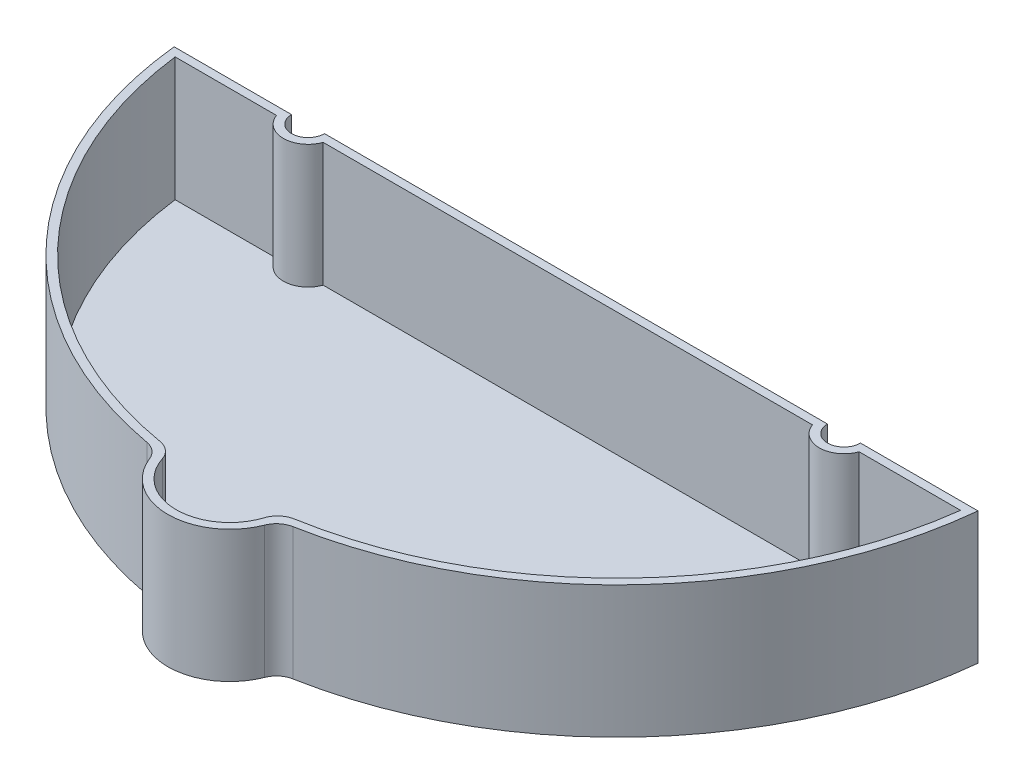
from build123d import *

# Parameters (mm, degrees)
EXTRUDE_START   = -2
EXTRUDE_1_DEPTH = 32
SHELL_1_T       = -2
FILLET_1_R      = 5


with BuildPart() as part:
    # 草图1 → 凸台-拉伸1 (new body)
    with BuildSketch(Plane(origin=(0, 0, 0), x_dir=(1, 0, 0), z_dir=(0, 1, 0)).offset(EXTRUDE_START)):
        with BuildLine():
            Line((-97.488460856, 50), (-69, 50))
            ThreePointArc((-69, 50), (-65, 46), (-61, 50))
            Line((-61, 50), (-7.5, 50))
            Line((-7.5, 50), (7.5, 50))
            Line((7.5, 50), (61, 50))
            ThreePointArc((61, 50), (65, 46), (69, 50))
            Line((69, 50), (97.488460856, 50))
            ThreePointArc((97.488460856, 50), (70.958011296, -7.594087263), (14.719298061, -36.888297872))
            ThreePointArc((14.719298061, -36.888297872), (0, -49), (-14.719298061, -36.888297872))
            ThreePointArc((-14.719298061, -36.888297872), (-70.958011296, -7.594087263), (-97.488460856, 50))
        make_face()
    extrude(amount=EXTRUDE_1_DEPTH)

    # 抽壳1
    shell_1_openings = [part.faces().sort_by_distance(p)[0] for p in [
        (0, 30, -11.801216643),
    ]]
    offset(amount=SHELL_1_T, openings=shell_1_openings, kind=Kind.INTERSECTION)

    # 圆角1
    fillet_1_edges = [part.edges().sort_by_distance(p)[0] for p in [
        (14.719298061, 14, 36.888297872),
        (-14.719298061, 14, 36.888297872),
        (-12.951461384, 15, 35.122340426),
        (12.951461384, 15, 35.122340426),
    ]]
    fillet(fillet_1_edges, radius=FILLET_1_R)


solid = part.part
